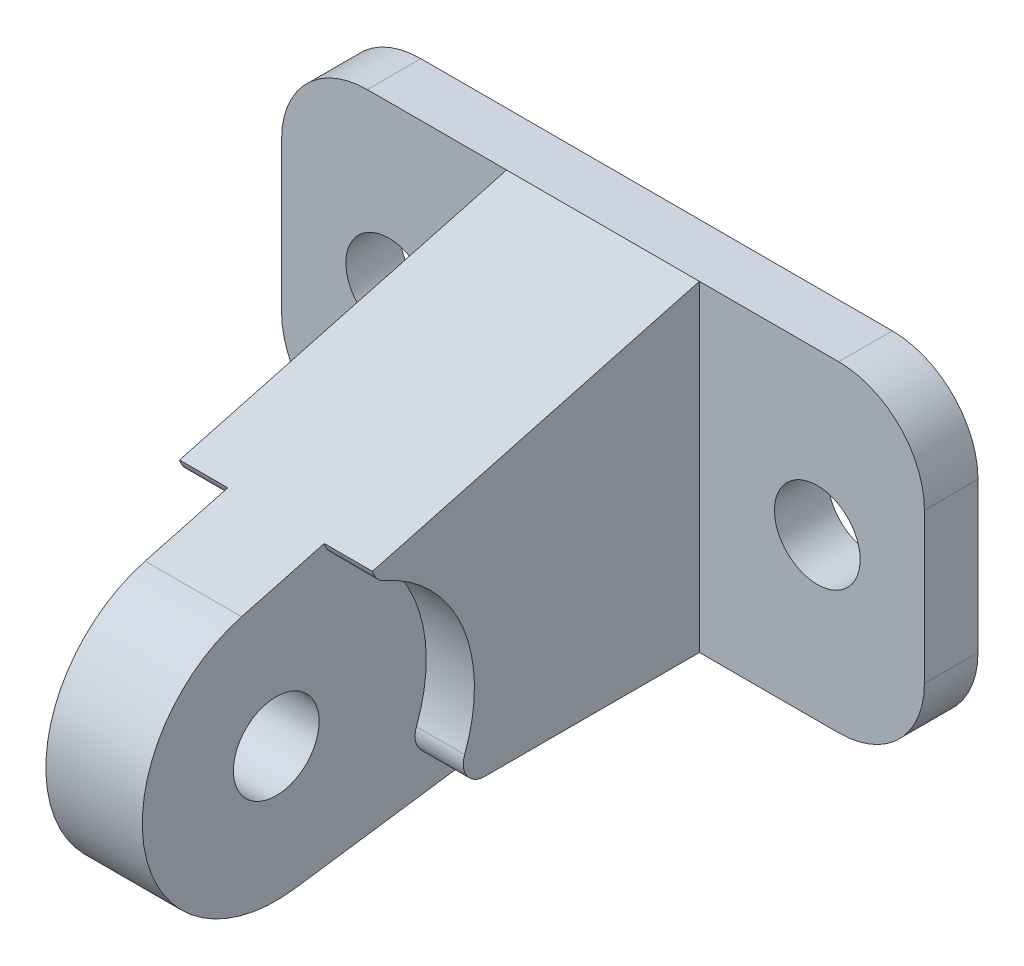
from build123d import *

# Parameters (mm, degrees)
SZKIC1_R                         = 4
DODANIE_WYCI_GNI_CIE1_DEPTH      = 5
SZKIC7_R                         = 4
DODANIE_WYCI_GNI_CIE3_DEPTH      = 4.5
DODANIE_WYCI_GNI_CIE5_DEPTH      = 4.5
DODANIE_WYCI_GNI_CIE5_DEPTH_BACK = 13.5


with BuildPart() as part:
    # Szkic1 → Dodanie-wyciągnięcie1 (new body)
    with BuildSketch(Plane.XY):
        with BuildLine():
            Line((-22, 15), (22, 15))
            ThreePointArc((22, 15), (27.656854249, 12.656854249), (30, 7))
            Line((30, 7), (30, -7))
            ThreePointArc((30, -7), (27.656854249, -12.656854249), (22, -15))
            Line((22, -15), (-22, -15))
            ThreePointArc((-22, -15), (-27.656854249, -12.656854249), (-30, -7))
            Line((-30, -7), (-30, 7))
            ThreePointArc((-30, 7), (-27.656854249, 12.656854249), (-22, 15))
        make_face()
        with Locations((-20, 0)):
            Circle(SZKIC1_R, mode=Mode.SUBTRACT)
        with Locations((20, 0)):
            Circle(SZKIC1_R, mode=Mode.SUBTRACT)
    extrude(amount=DODANIE_WYCI_GNI_CIE1_DEPTH)

    # Szkic7 → Dodanie-wyciągnięcie3 (add, symmetric)
    with BuildSketch(Plane(origin=(0, 0, 0), x_dir=(0, 0, -1), z_dir=(1, 0, 0))):
        with BuildLine():
            Line((-5, 15), (-43.235238064, 4.754898838))
            ThreePointArc((-43.235238064, 4.754898838), (-52.248209815, -9.815442471), (-38.251909732, -19.696337656))
            Line((-38.251909732, -19.696337656), (-5, -15))
            Line((-5, -15), (-5, 15))
        make_face()
        with Locations((-40, -7.31917399)):
            Circle(SZKIC7_R, mode=Mode.SUBTRACT)
    extrude(amount=DODANIE_WYCI_GNI_CIE3_DEPTH, both=True)

    # Szkic8 → Dodanie-wyciągnięcie5 (add, two sides: drawn at the far end of the back side and taken through both)
    with BuildSketch(Plane(origin=(4.5, 0, 0), x_dir=(0, 0, -1), z_dir=(1, 0, 0)).offset(-DODANIE_WYCI_GNI_CIE5_DEPTH_BACK)):
        with BuildLine():
            Line((-5, -15), (-5, 15))
            Line((-5, 15), (-35.519913082, 6.822213937))
            ThreePointArc((-35.519913082, 6.822213937), (-35.104612696, 6.035983837), (-34.389553751, 5.507473775))
            ThreePointArc((-34.389553751, 5.507473775), (-27.092900988, -1.896370741), (-26.91214627, -12.289896749))
            ThreePointArc((-26.91214627, -12.289896749), (-26.688692003, -14.135736214), (-25.04245288, -15))
            Line((-25.04245288, -15), (-5, -15))
        make_face()
    extrude(amount=DODANIE_WYCI_GNI_CIE5_DEPTH + DODANIE_WYCI_GNI_CIE5_DEPTH_BACK)


solid = part.part
